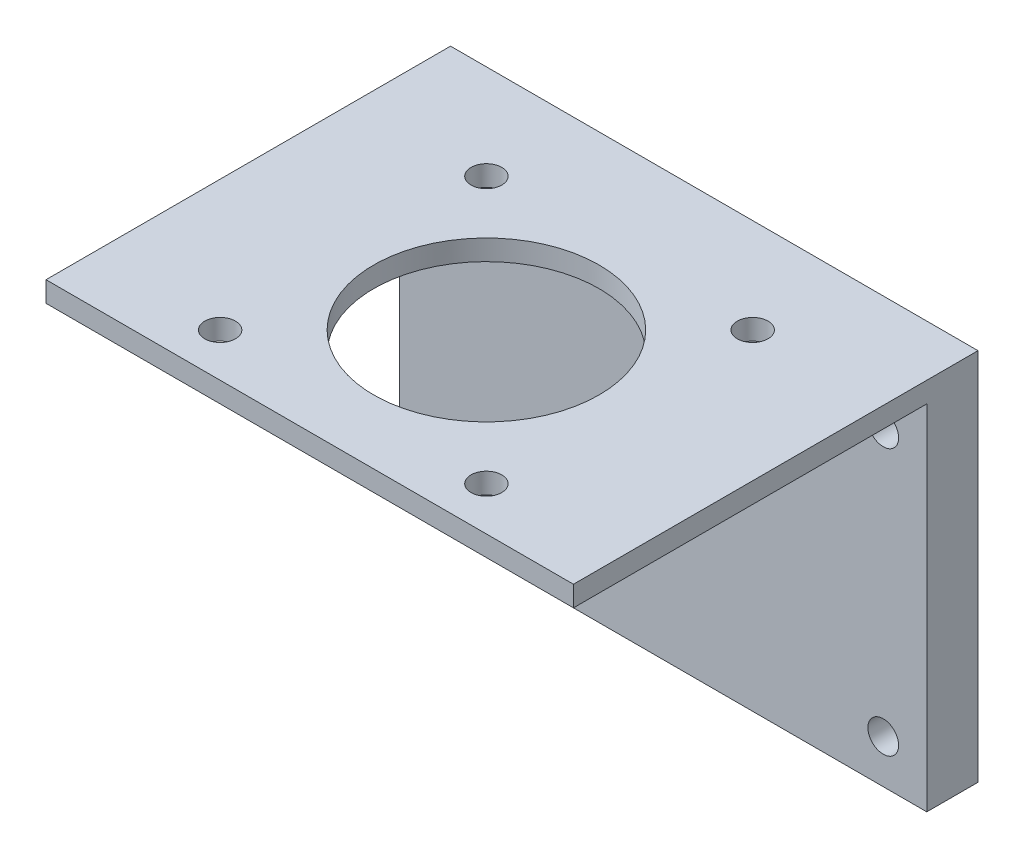
from build123d import *

# Parameters (mm, degrees)
ESQUISSE1_W             = 51.5
ESQUISSE1_H             = 36.5
BOSS_EXTRU_1_DEPTH      = 5
ESQUISSE2_R             = 1.5
ENL_V_MAT_EXTRU_1_DEPTH = 5
ESQUISSE3_W             = 51.5
ESQUISSE3_H             = 2
BOSS_EXTRU_3_DEPTH      = 34.5
ESQUISSE5_R             = 1.5
ESQUISSE5_R_2           = 11
ENL_V_MAT_EXTRU_3_DEPTH = 34.5


with BuildPart() as part:
    # Esquisse1 → Boss.-Extru.1 (new body)
    with BuildSketch(Plane.XY):
        with Locations((11.117800259, -7.384341637)):
            Rectangle(ESQUISSE1_W, ESQUISSE1_H)
    extrude(amount=BOSS_EXTRU_1_DEPTH)

    # Esquisse2 → Enlèv. mat.-Extru.1 (cut)
    with BuildSketch(Plane.XY.offset(5)):
        with Locations((-10.382199741, 4.615658363)):
            Circle(ESQUISSE2_R)
        with Locations((-10.382199741, -21.384341637)):
            Circle(ESQUISSE2_R)
        with Locations((32.617800259, -21.384341637)):
            Circle(ESQUISSE2_R)
        with Locations((32.617800259, 4.615658363)):
            Circle(ESQUISSE2_R)
    extrude(amount=-ENL_V_MAT_EXTRU_1_DEPTH, mode=Mode.SUBTRACT)

    # Esquisse3 → Boss.-Extru.3 (add)
    with BuildSketch(Plane.XY.offset(5)):
        with Locations((11.117800259, 9.865658363)):
            Rectangle(ESQUISSE3_W, ESQUISSE3_H)
    extrude(amount=BOSS_EXTRU_3_DEPTH)

    # Esquisse5 → Enlèv. mat.-Extru.3 (cut)
    with BuildSketch(Plane.XZ.offset(-8.865658363)):
        with Locations((-1.882199741, 35.25)):
            Circle(ESQUISSE5_R)
        with Locations((24.117800259, 35.25)):
            Circle(ESQUISSE5_R)
        with Locations((-1.882199741, 9.25)):
            Circle(ESQUISSE5_R)
        with Locations((24.117800259, 9.25)):
            Circle(ESQUISSE5_R)
        with Locations((11.117800259, 22.25)):
            Circle(ESQUISSE5_R_2)
    extrude(amount=-ENL_V_MAT_EXTRU_3_DEPTH, mode=Mode.SUBTRACT)


solid = part.part
